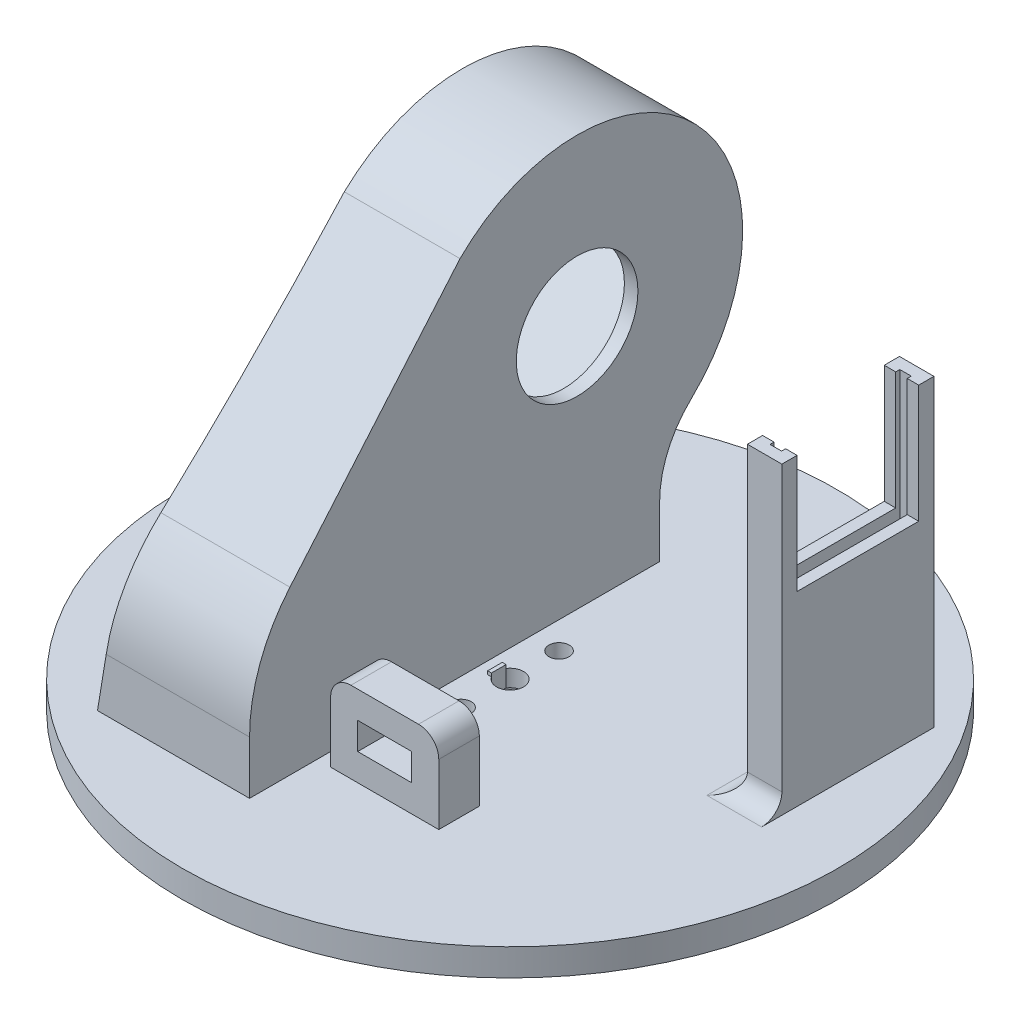
from build123d import *

# Parameters (mm, degrees)
SKETCH2_R                       = 48.5
BOSS_EXTRUDE1_DEPTH             = 4
SKETCH4_R                       = 1.5
CUT_EXTRUDE2_DEPTH              = 69.705894944
SKETCH5_R                       = 3.75
CUT_EXTRUDE3_DEPTH              = 1.5
BOSS_EXTRUDE2_DEPTH             = 14
CUT_EXTRUDE5_REACH              = 97.597
SKETCH9_R                       = 1.3
CUT_EXTRUDE6_DEPTH              = 7.5
CUT_EXTRUDE9_REACH              = 96.471
SKETCH11_R                      = 9
BOSS_EXTRUDE7_DEPTH             = 9
BOSS_EXTRUDE7_DIRECTION_2_REACH = 104.912
BOSS_EXTRUDE10_DEPTH            = 9
SKETCH27_W                      = 16
SKETCH27_H                      = 6
BOSS_EXTRUDE11_DEPTH            = 12
FILLET6_R                       = 3
CUT_EXTRUDE16_REACH             = 111.016
SKETCH28_W                      = 8
SKETCH28_H                      = 4
CUT_EXTRUDE17_DEPTH             = 95.342420983
CUT_EXTRUDE17_DEPTH_BACK        = 95.342420983
CROQUIS4_W                      = 5.1
CROQUIS4_H                      = 22.5
SALIENTE_EXTRUIR1_DEPTH         = 45
CROQUIS5_W                      = 1.7
CROQUIS5_H                      = 19.2
CORTAR_EXTRUIR1_DEPTH           = 19.5
CROQUIS6_W                      = 18
CROQUIS6_H                      = 17.447039648
CORTAR_EXTRUIR2_DEPTH           = 19.5
REDONDEO1_R                     = 3
CROQUIS7_R                      = 1.99
CORTAR_EXTRUIR3_DEPTH           = 10
CROQUIS8_W                      = 0.564126112
CROQUIS8_H                      = 2.164439882
SALIENTE_EXTRUIR2_DEPTH         = 3


with BuildPart() as part:
    # Sketch2 → Boss-Extrude1 (new body)
    with BuildSketch(Plane(origin=(0, 0, 0), x_dir=(1, 0, 0), z_dir=(0, 1, 0))):
        with Locations(Location((0, 0, 0), (0, 0, 270))):
            Circle(SKETCH2_R)
    extrude(amount=BOSS_EXTRUDE1_DEPTH)

    # Sketch4 → Cut-Extrude2 (cut, through all)
    with BuildSketch(Plane.XZ):
        with Locations(Location((0, 7.25, 0), (0, 0, 270))):
            Circle(SKETCH4_R)
        with Locations(Location((0, -7.25, 0), (0, 0, 270))):
            Circle(SKETCH4_R)
    extrude(amount=-CUT_EXTRUDE2_DEPTH, mode=Mode.SUBTRACT)

    # Sketch5 → Cut-Extrude3 (cut)
    with BuildSketch(Plane.XZ):
        with Locations(Location((0, 0, 0), (0, 0, 270))):
            Circle(SKETCH5_R)
    extrude(amount=-CUT_EXTRUDE3_DEPTH, mode=Mode.SUBTRACT)

    # Sketch7 → Boss-Extrude2 (add)
    with BuildSketch(Plane(origin=(-4, 0, 0), x_dir=(0, 0, -1), z_dir=(1, 0, 0))):
        with BuildLine():
            Line((23.129947874, 4), (23.129947874, 11.644549616))
            ThreePointArc((23.129947874, 11.644549616), (24.589048403, 18.743749901), (28.729797284, 24.692011643))
            ThreePointArc((28.729797284, 24.692011643), (29.313383054, 55.284736897), (-1.284289494, 55.479275971))
            Line((-1.284289494, 55.479275971), (-27.227315747, 29.536249718))
            ThreePointArc((-27.227315747, 29.536249718), (-32.64663453, 21.425665997), (-34.549646217, 11.858580188))
            Line((-34.549646217, 11.858580188), (-34.549646217, 4))
            Line((-34.549646217, 4), (23.129947874, 4))
        make_face()
    extrude(amount=-BOSS_EXTRUDE2_DEPTH)

    # Sketch8 → Cut-Extrude5 (cut, up to next)
    with BuildSketch(Plane(origin=(-6, 0, 0), x_dir=(0, 0, -1), z_dir=(1, 0, 0)), mode=Mode.PRIVATE) as cut_extrude5_sk1:
        Polygon((-15.249648422, 25.957567857), (13.741729607, 54.948945886), (28.590972012, 40.099703481), (-0.400406017, 11.108325452), align=None)
    cut_extrude5_tool1 = extrude(cut_extrude5_sk1.sketch, amount=-CUT_EXTRUDE5_REACH, mode=Mode.PRIVATE) & part.part
    add(cut_extrude5_tool1.solids().sort_by_distance((-6, 33.028636, -6.670662))[0], mode=Mode.SUBTRACT)

    # Sketch9 → Cut-Extrude6 (cut)
    with BuildSketch(Plane.ZY.offset(18)):
        with Locations((-20.105690637, 53.534732323)):
            Circle(SKETCH9_R)
        with Locations((-27.176758449, 46.463664511)):
            Circle(SKETCH9_R)
        with Locations((6.764367048, 12.522539014)):
            Circle(SKETCH9_R)
        with Locations((13.83543486, 19.593606826)):
            Circle(SKETCH9_R)
    extrude(amount=-CUT_EXTRUDE6_DEPTH, mode=Mode.SUBTRACT)

    # Sketch11 → Cut-Extrude9 (cut, up to next)
    with BuildSketch(Plane(origin=(-4, 0, 0), x_dir=(0, 0, -1), z_dir=(1, 0, 0)), mode=Mode.PRIVATE) as cut_extrude9_sk1:
        with Locations((13.918506302, 40.276480176)):
            Circle(SKETCH11_R)
    cut_extrude9_tool1 = extrude(cut_extrude9_sk1.sketch, amount=-CUT_EXTRUDE9_REACH, mode=Mode.PRIVATE) & part.part
    add(cut_extrude9_tool1.solids().sort_by_distance((-4, 40.27648, -13.918506))[0], mode=Mode.SUBTRACT)

    # Sketch17 → Boss-Extrude7 (add)
    with BuildSketch(Plane.ZY.offset(18)):
        with BuildLine():
            ThreePointArc((34.549646217, 11.858580188), (33.008342843, 20.500891953), (28.574482006, 28.077569775))
            ThreePointArc((28.574482006, 28.077569775), (27.915386359, 28.820289685), (27.227315747, 29.536249718))
            Line((27.227315747, 29.536249718), (1.284289494, 55.479275971))
            Line((1.284289494, 55.479275971), (26.295003593, 26.127182305))
            ThreePointArc((26.295003593, 26.127182305), (30.194232218, 19.461281607), (31.549646217, 11.858580188))
            Line((31.549646217, 11.858580188), (31.549646217, 4))
            Line((31.549646217, 4), (34.549646217, 4))
            Line((34.549646217, 4), (34.549646217, 11.858580188))
        make_face()
        with BuildLine():
            Line((28.574482006, 28.077569775), (3.405609837, 57.600596315))
            ThreePointArc((3.405609837, 57.600596315), (-31.461505391, 57.378912253), (-30.796489049, 22.517434639))
            ThreePointArc((-30.796489049, 22.517434639), (-27.345864981, 17.560549854), (-26.129947874, 11.644549616))
            Line((-26.129947874, 11.644549616), (-26.129947874, 4))
            Line((-26.129947874, 4), (-23.129947874, 4))
            Line((-23.129947874, 4), (-23.129947874, 11.644549616))
            ThreePointArc((-23.129947874, 11.644549616), (-24.589048403, 18.743749901), (-28.729797284, 24.692011643))
            ThreePointArc((-28.729797284, 24.692011643), (-29.313383054, 55.284736897), (1.284289494, 55.479275971))
            Line((1.284289494, 55.479275971), (27.227315747, 29.536249718))
            ThreePointArc((27.227315747, 29.536249718), (27.915386359, 28.820289685), (28.574482006, 28.077569775))
        make_face()
    extrude(amount=BOSS_EXTRUDE7_DEPTH)

    # Boss-Extrude7 direction 2: up to this face of the body (flat: up to its plane)
    boss_extrude7_direction_2_end = Plane(part.part.faces().sort_by_distance((-4, 28.276431801, -1.649713195))[0])
    # Sketch17 → Boss-Extrude7 direction 2 (add, up to the picked face)
    with BuildSketch(Plane.ZY.offset(18), mode=Mode.PRIVATE) as boss_extrude7_direction_2_sk1:
        with BuildLine():
            ThreePointArc((34.549646217, 11.858580188), (33.008342843, 20.500891953), (28.574482006, 28.077569775))
            ThreePointArc((28.574482006, 28.077569775), (27.915386359, 28.820289685), (27.227315747, 29.536249718))
            Line((27.227315747, 29.536249718), (1.284289494, 55.479275971))
            Line((1.284289494, 55.479275971), (26.295003593, 26.127182305))
            ThreePointArc((26.295003593, 26.127182305), (30.194232218, 19.461281607), (31.549646217, 11.858580188))
            Line((31.549646217, 11.858580188), (31.549646217, 4))
            Line((31.549646217, 4), (34.549646217, 4))
            Line((34.549646217, 4), (34.549646217, 11.858580188))
        make_face()
    boss_extrude7_direction_2_tool1 = split(extrude(boss_extrude7_direction_2_sk1.sketch, amount=-BOSS_EXTRUDE7_DIRECTION_2_REACH, mode=Mode.PRIVATE), bisect_by=boss_extrude7_direction_2_end, keep=Keep.BOTH, mode=Mode.PRIVATE)
    # Sketch17 → Boss-Extrude7 direction 2 (add, up to the picked face)
    with BuildSketch(Plane.ZY.offset(18), mode=Mode.PRIVATE) as boss_extrude7_direction_2_sk2:
        with BuildLine():
            Line((28.574482006, 28.077569775), (3.405609837, 57.600596315))
            ThreePointArc((3.405609837, 57.600596315), (-31.461505391, 57.378912253), (-30.796489049, 22.517434639))
            ThreePointArc((-30.796489049, 22.517434639), (-27.345864981, 17.560549854), (-26.129947874, 11.644549616))
            Line((-26.129947874, 11.644549616), (-26.129947874, 4))
            Line((-26.129947874, 4), (-23.129947874, 4))
            Line((-23.129947874, 4), (-23.129947874, 11.644549616))
            ThreePointArc((-23.129947874, 11.644549616), (-24.589048403, 18.743749901), (-28.729797284, 24.692011643))
            ThreePointArc((-28.729797284, 24.692011643), (-29.313383054, 55.284736897), (1.284289494, 55.479275971))
            Line((1.284289494, 55.479275971), (27.227315747, 29.536249718))
            ThreePointArc((27.227315747, 29.536249718), (27.915386359, 28.820289685), (28.574482006, 28.077569775))
        make_face()
    boss_extrude7_direction_2_tool2 = split(extrude(boss_extrude7_direction_2_sk2.sketch, amount=-BOSS_EXTRUDE7_DIRECTION_2_REACH, mode=Mode.PRIVATE), bisect_by=boss_extrude7_direction_2_end, keep=Keep.BOTH, mode=Mode.PRIVATE)
    add(boss_extrude7_direction_2_tool1.solids().sort_by(Axis((-18, 4.612919, 33.049646), (1, 0, 0)))[0])
    add(boss_extrude7_direction_2_tool2.solids().sort_by(Axis((-18, 43.147366, 14.895406), (1, 0, 0)))[0])

    # Sketch25 → Boss-Extrude10 (add)
    with BuildSketch(Plane.ZY.offset(18)):
        with BuildLine():
            ThreePointArc((-28.729797284, 24.692011643), (-24.589048403, 18.743749901), (-23.129947874, 11.644549616))
            Line((-23.129947874, 11.644549616), (-23.129947874, 4))
            Line((-23.129947874, 4), (-15.129947874, 4))
            add(Edge.make_bspline(
                [(-28.729797284, 24.692011643), (-21.954867515, 18.253200081), (-19.09405247, 12.798017691), (-15.129947874, 4)],
                knots=[0, 0, 0, 0, 1, 1, 1, 1], degree=3))
        make_face()
        with BuildLine():
            add(Edge.make_bspline(
                [(11.751619577, 43.19501844), (26.551255916, 25.8264495), (25.549646217, 4)],
                knots=[0, 0, 0, 1, 1, 1], degree=2))
            Line((25.549646217, 4), (31.549646217, 4))
            Line((31.549646217, 4), (31.549646217, 11.858580188))
            ThreePointArc((31.549646217, 11.858580188), (30.194232218, 19.461281607), (26.295003593, 26.127182305))
            Line((26.295003593, 26.127182305), (11.751619577, 43.19501844))
        make_face()
    extrude(amount=BOSS_EXTRUDE10_DEPTH)

    # Sketch27 → Boss-Extrude11 (add)
    with BuildSketch(Plane(origin=(0, 4, 0), x_dir=(1, 0, 0), z_dir=(0, 1, 0))):
        with Locations((6, -21.549646217)):
            Rectangle(SKETCH27_W, SKETCH27_H)
    extrude(amount=BOSS_EXTRUDE11_DEPTH)

    # Fillet6
    fillet6_edges = [part.edges().sort_by_distance(p)[0] for p in [
        (-2, 16, 21.549646217),
        (14, 16, 21.549646217),
    ]]
    fillet(fillet6_edges, radius=FILLET6_R)

    # Sketch28 → Cut-Extrude16 (cut, up to next)
    with BuildSketch(Plane.XY.offset(24.549646217), mode=Mode.PRIVATE) as cut_extrude16_sk1:
        with Locations((6, 10)):
            Rectangle(SKETCH28_W, SKETCH28_H)
    cut_extrude16_tool1 = extrude(cut_extrude16_sk1.sketch, amount=-CUT_EXTRUDE16_REACH, mode=Mode.PRIVATE) & part.part
    add(cut_extrude16_tool1.solids().sort_by_distance((6, 10, 24.549646))[0], mode=Mode.SUBTRACT)

    # Sketch29 → Cut-Extrude17 (cut, two sides: drawn at the far end of the back side and taken through both)
    with BuildSketch(Plane.XY.offset(-CUT_EXTRUDE17_DEPTH_BACK)):
        with BuildLine():
            Line((-21, 64.776480176), (-27, 64.776480176))
            Line((-27, 64.776480176), (-27, 4))
            Line((-27, 4), (-26.5, 4))
            add(Edge.make_bspline(
                [(-21, 64.776480176), (-21.220459696, 34.140901434), (-26.5, 4)],
                knots=[0, 0, 0, 1, 1, 1], degree=2))
        make_face()
    extrude(amount=CUT_EXTRUDE17_DEPTH + CUT_EXTRUDE17_DEPTH_BACK, mode=Mode.SUBTRACT)

    # Croquis4 → Saliente-Extruir1 (add)
    with BuildSketch(Plane(origin=(0, 4, 0), x_dir=(1, 0, 0), z_dir=(0, 1, 0))):
        with Locations((35, 13.919947874)):
            Rectangle(CROQUIS4_W, CROQUIS4_H)
    extrude(amount=SALIENTE_EXTRUIR1_DEPTH)

    # Croquis5 → Cortar-Extruir1 (cut)
    with BuildSketch(Plane(origin=(0, 49, 0), x_dir=(1, 0, 0), z_dir=(0, 1, 0))):
        with Locations((35, 13.919947874)):
            Rectangle(CROQUIS5_W, CROQUIS5_H)
    extrude(amount=-CORTAR_EXTRUIR1_DEPTH, mode=Mode.SUBTRACT)

    # Croquis6 → Cortar-Extruir2 (cut)
    with BuildSketch(Plane(origin=(37.55, 0, 0), x_dir=(0, 0, -1), z_dir=(1, 0, 0))):
        with Locations((13.918506302, 40.276480176)):
            Rectangle(CROQUIS6_W, CROQUIS6_H)
    extrude(amount=-CORTAR_EXTRUIR2_DEPTH, mode=Mode.SUBTRACT)

    # Redondeo1
    redondeo1_edges = [part.edges().sort_by_distance(p)[0] for p in [
        (32.45, 4, -13.919947874),
        (35, 4, -2.669947874),
    ]]
    fillet(redondeo1_edges, radius=REDONDEO1_R)

    # Croquis7 → Cortar-Extruir3 (cut)
    with BuildSketch(Plane.XZ.offset(-1.5)):
        with Locations(Location((0, 0, 0), (0, 0, 270))):
            Circle(CROQUIS7_R)
    extrude(amount=-CORTAR_EXTRUIR3_DEPTH, mode=Mode.SUBTRACT)

    # Croquis8 → Saliente-Extruir2 (add)
    with BuildSketch(Plane.XZ.offset(-1.5)):
        with Locations((-1.952063056, 0)):
            Rectangle(CROQUIS8_W, CROQUIS8_H)
    extrude(amount=-SALIENTE_EXTRUIR2_DEPTH)


solid = part.part
